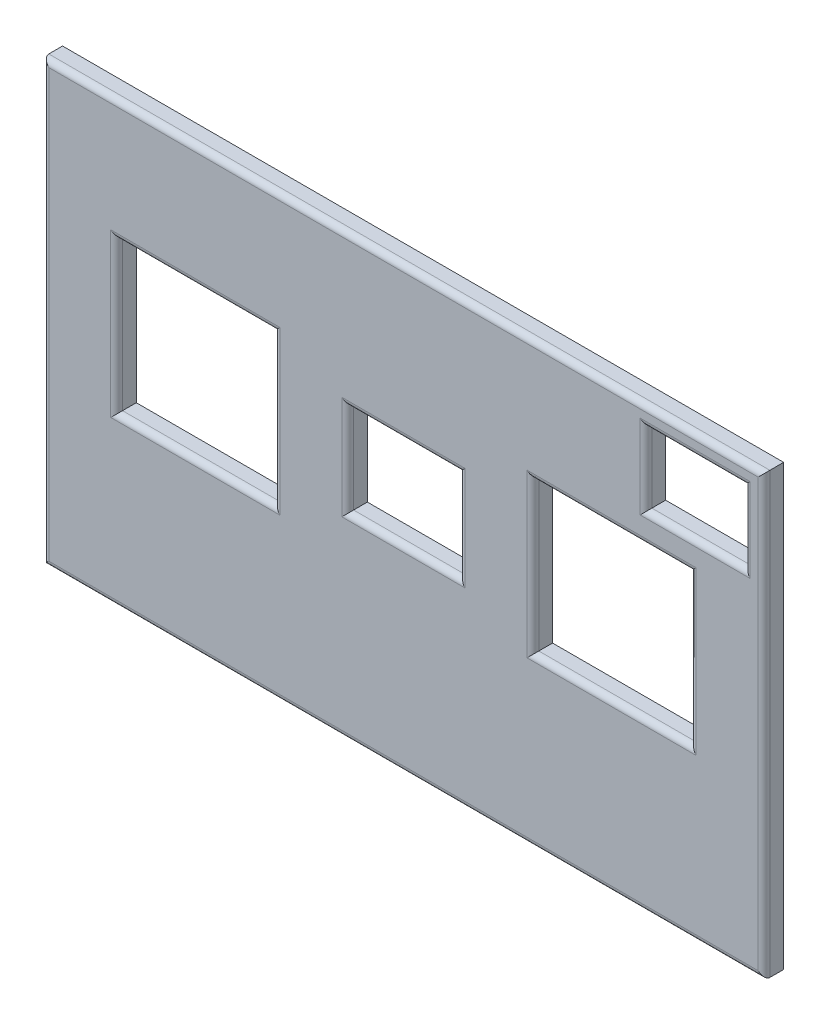
from build123d import *

# Parameters (mm, degrees)
SKETCH1_W           = 110
SKETCH1_H           = 67
BOSS_EXTRUDE1_DEPTH = 3
CUT_EXTRUDE1_REACH  = 66.469
SKETCH2_W           = 24
SKETCH2_H           = 23
SKETCH2_W_2         = 17
SKETCH2_H_2         = 14
SKETCH2_W_3         = 15
SKETCH2_H_3         = 11
FILLET1_R           = 0.9


with BuildPart() as part:
    # Sketch1 → Boss-Extrude1 (new body)
    with BuildSketch(Plane.XY):
        Rectangle(SKETCH1_W, SKETCH1_H)
    extrude(amount=BOSS_EXTRUDE1_DEPTH)

    # Sketch2 → Cut-Extrude1 (cut, up to next)
    with BuildSketch(Plane.XY.offset(3), mode=Mode.PRIVATE) as cut_extrude1_sk1:
        with Locations((-31.75, 3.5)):
            Rectangle(SKETCH2_W, SKETCH2_H)
    cut_extrude1_tool1 = extrude(cut_extrude1_sk1.sketch, amount=-CUT_EXTRUDE1_REACH, mode=Mode.PRIVATE) & part.part
    # Sketch2 → Cut-Extrude1 (cut, up to next)
    with BuildSketch(Plane.XY.offset(3), mode=Mode.PRIVATE) as cut_extrude1_sk2:
        with Locations((0, 3.5)):
            Rectangle(SKETCH2_W_2, SKETCH2_H_2)
    cut_extrude1_tool2 = extrude(cut_extrude1_sk2.sketch, amount=-CUT_EXTRUDE1_REACH, mode=Mode.PRIVATE) & part.part
    # Sketch2 → Cut-Extrude1 (cut, up to next)
    with BuildSketch(Plane.XY.offset(3), mode=Mode.PRIVATE) as cut_extrude1_sk3:
        with Locations((31.75, 3.5)):
            Rectangle(SKETCH2_W, SKETCH2_H)
    cut_extrude1_tool3 = extrude(cut_extrude1_sk3.sketch, amount=-CUT_EXTRUDE1_REACH, mode=Mode.PRIVATE) & part.part
    # Sketch2 → Cut-Extrude1 (cut, up to next)
    with BuildSketch(Plane.XY.offset(3), mode=Mode.PRIVATE) as cut_extrude1_sk4:
        with Locations((44.5, 25)):
            Rectangle(SKETCH2_W_3, SKETCH2_H_3)
    cut_extrude1_tool4 = extrude(cut_extrude1_sk4.sketch, amount=-CUT_EXTRUDE1_REACH, mode=Mode.PRIVATE) & part.part
    add(cut_extrude1_tool1.solids().sort_by_distance((-31.75, 3.5, 3))[0], mode=Mode.SUBTRACT)
    add(cut_extrude1_tool2.solids().sort_by_distance((0, 3.5, 3))[0], mode=Mode.SUBTRACT)
    add(cut_extrude1_tool3.solids().sort_by_distance((31.75, 3.5, 3))[0], mode=Mode.SUBTRACT)
    add(cut_extrude1_tool4.solids().sort_by_distance((44.5, 25, 3))[0], mode=Mode.SUBTRACT)

    # Fillet1
    fillet1_edges = [part.edges().sort_by_distance(p)[0] for p in [
        (-55, 0, 3),
        (0, -33.5, 3),
        (-19.75, 3.5, 3),
        (-31.75, 15, 3),
        (-43.75, 3.5, 3),
        (-31.75, -8, 3),
        (8.5, 3.5, 3),
        (0, 10.5, 3),
        (-8.5, 3.5, 3),
        (0, -3.5, 3),
        (43.75, 3.5, 3),
        (31.75, 15, 3),
        (19.75, 3.5, 3),
        (31.75, -8, 3),
        (52, 25, 3),
        (44.5, 30.5, 3),
        (37, 25, 3),
        (44.5, 19.5, 3),
        (55, 0, 3),
        (0, 33.5, 3),
    ]]
    fillet(fillet1_edges, radius=FILLET1_R)


solid = part.part
